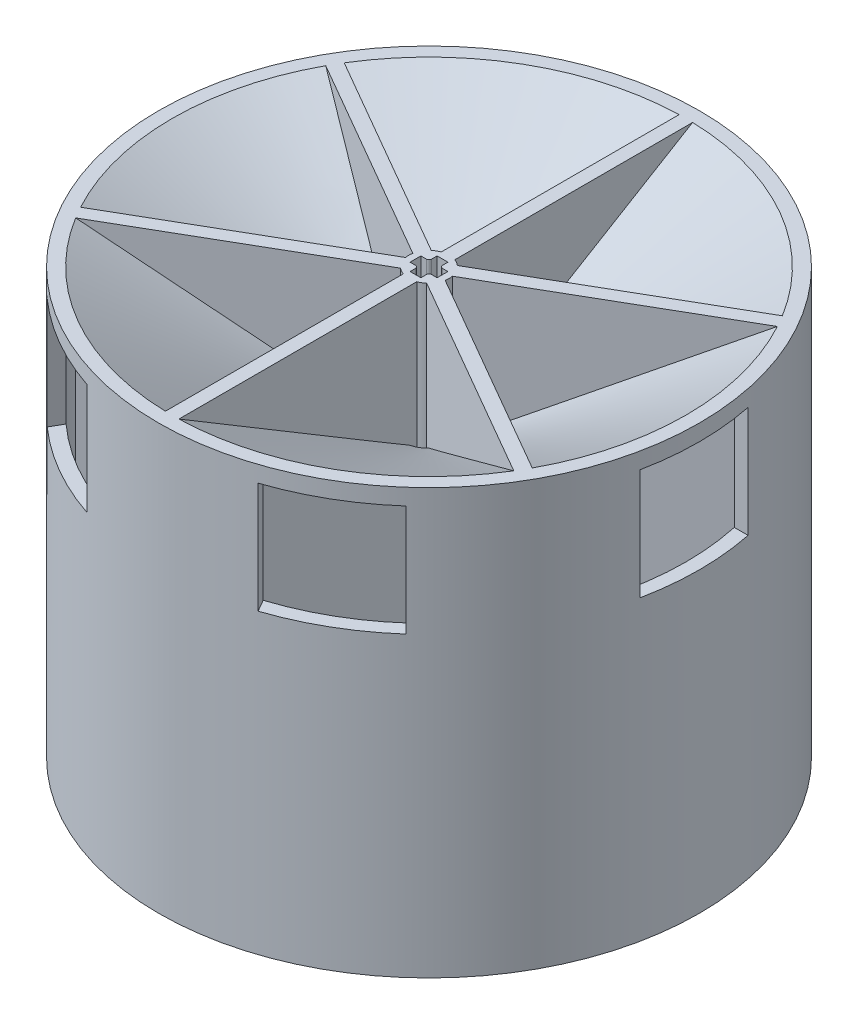
from build123d import *
from build123d.topology import SkipClean

# Parameters (mm, degrees)
SKETCH1_R           = 50.000537734
BOSS_EXTRUDE1_DEPTH = 50
BOSS_EXTRUDE2_START = -30
SKETCH4_R           = 50.000537734
BOSS_EXTRUDE2_DEPTH = 30
CUT_EXTRUDE2_DEPTH  = 25
SKETCH9_R           = 50.000537734
CUT_EXTRUDE3_DEPTH  = 1.5
BOSS_EXTRUDE3_DEPTH = 3
CUT_EXTRUDE4_DEPTH  = 84


with BuildPart() as part:
    # Sketch1 → Boss-Extrude1 (new body)
    with BuildSketch(Plane(origin=(0, 0, 0), x_dir=(1, 0, 0), z_dir=(0, 1, 0))):
        with Locations(Location((0, 0, 0), (0, 0, 270))):
            Circle(SKETCH1_R)
        with BuildLine():
            Line((-40.497426226, -24.824575606), (-2.413888572, -2.83703489))
            ThreePointArc((-2.413888572, -2.83703489), (-1.8625, -3.225944629), (-1.25, -3.50900627))
            Line((-1.25, -3.50900627), (-1.25, -47.484087703))
            ThreePointArc((-1.25, -47.484087703), (-23.750268867, -41.136672371), (-40.497426226, -24.824575606))
        make_face(mode=Mode.SUBTRACT)
        with BuildLine():
            Line((1.25, -47.484087703), (1.25, -3.50900627))
            ThreePointArc((1.25, -3.50900627), (1.8625, -3.225944629), (2.413888572, -2.83703489))
            Line((2.413888572, -2.83703489), (40.497426226, -24.824575606))
            ThreePointArc((40.497426226, -24.824575606), (23.750268867, -41.136672371), (1.25, -47.484087703))
        make_face(mode=Mode.SUBTRACT)
        with BuildLine():
            Line((-41.747426226, -22.659512097), (-3.663888572, -0.67197138))
            ThreePointArc((-3.663888572, -0.67197138), (-3.725, 0), (-3.663888572, 0.67197138))
            Line((-3.663888572, 0.67197138), (-41.747426226, 22.659512097))
            ThreePointArc((-41.747426226, 22.659512097), (-47.500537734, 0), (-41.747426226, -22.659512097))
        make_face(mode=Mode.SUBTRACT)
        with BuildLine():
            Line((-40.497426226, 24.824575606), (-2.413888572, 2.83703489))
            ThreePointArc((-2.413888572, 2.83703489), (-1.8625, 3.225944629), (-1.25, 3.50900627))
            Line((-1.25, 3.50900627), (-1.25, 47.484087703))
            ThreePointArc((-1.25, 47.484087703), (-23.750268867, 41.136672371), (-40.497426226, 24.824575606))
        make_face(mode=Mode.SUBTRACT)
        with BuildLine():
            Line((1.25, 47.484087703), (1.25, 3.50900627))
            ThreePointArc((1.25, 3.50900627), (1.8625, 3.225944629), (2.413888572, 2.83703489))
            Line((2.413888572, 2.83703489), (40.497426226, 24.824575606))
            ThreePointArc((40.497426226, 24.824575606), (23.750268867, 41.136672371), (1.25, 47.484087703))
        make_face(mode=Mode.SUBTRACT)
        with BuildLine():
            Line((41.747426226, 22.659512097), (3.663888572, 0.67197138))
            ThreePointArc((3.663888572, 0.67197138), (3.725, 0), (3.663888572, -0.67197138))
            Line((3.663888572, -0.67197138), (41.747426226, -22.659512097))
            ThreePointArc((41.747426226, -22.659512097), (47.500537734, 0), (41.747426226, 22.659512097))
        make_face(mode=Mode.SUBTRACT)
        with BuildLine():
            Line((-1, 2.5), (1, 2.5))
            Line((1, 2.5), (1, 1.5))
            ThreePointArc((1, 1.5), (1.146446609, 1.146446609), (1.5, 1))
            Line((1.5, 1), (2.5, 1))
            Line((2.5, 1), (2.5, -1))
            Line((2.5, -1), (1.5, -1))
            ThreePointArc((1.5, -1), (1.146446609, -1.146446609), (1, -1.5))
            Line((1, -1.5), (1, -2.5))
            Line((1, -2.5), (-1, -2.5))
            Line((-1, -2.5), (-1, -1.5))
            ThreePointArc((-1, -1.5), (-1.146446609, -1.146446609), (-1.5, -1))
            Line((-1.5, -1), (-2.5, -1))
            Line((-2.5, -1), (-2.5, 1))
            Line((-2.5, 1), (-1.5, 1))
            ThreePointArc((-1.5, 1), (-1.146446609, 1.146446609), (-1, 1.5))
            Line((-1, 1.5), (-1, 2.5))
        make_face(mode=Mode.SUBTRACT)
    extrude(amount=-BOSS_EXTRUDE1_DEPTH)

    # Sketch3 → Revolve1 (revolve)
    with BuildSketch(Plane.XY, mode=Mode.PRIVATE) as revolve1_sk:
        Polygon((1.120312319, 0), (5.082856331, 3.049681), (50.000537734, 30), (50.000537734, 0), (47.500537734, 0), (47.500537734, 25.584548484), (4.859165004, 0), align=None)
    revolve(revolve1_sk.sketch.rotate(Axis((0, 10.437160455, 0), (0, 1, 0)), 270), axis=Axis((0, 10.437160455, 0), (0, 1, 0)))

    # Sketch4 → Boss-Extrude2 (add)
    with SkipClean():  # the faces are left unmerged after this step: merging them gives an invalid solid
        with BuildSketch(Plane.XZ.offset(BOSS_EXTRUDE2_START)):
            with Locations(Location((0, 0, 0), (0, 0, 90))):
                Circle(SKETCH4_R)
            with BuildLine():
                Line((-40.497426226, -24.824575606), (-2.413888572, -2.83703489))
                ThreePointArc((-2.413888572, -2.83703489), (-1.8625, -3.225944629), (-1.25, -3.50900627))
                Line((-1.25, -3.50900627), (-1.25, -47.484087703))
                ThreePointArc((-1.25, -47.484087703), (-23.750268867, -41.136672371), (-40.497426226, -24.824575606))
            make_face(mode=Mode.SUBTRACT)
            with BuildLine():
                Line((1.25, -47.484087703), (1.25, -3.50900627))
                ThreePointArc((1.25, -3.50900627), (1.8625, -3.225944629), (2.413888572, -2.83703489))
                Line((2.413888572, -2.83703489), (40.497426226, -24.824575606))
                ThreePointArc((40.497426226, -24.824575606), (23.750268867, -41.136672371), (1.25, -47.484087703))
            make_face(mode=Mode.SUBTRACT)
            with BuildLine():
                Line((-41.747426226, -22.659512097), (-3.663888572, -0.67197138))
                ThreePointArc((-3.663888572, -0.67197138), (-3.725, 0), (-3.663888572, 0.67197138))
                Line((-3.663888572, 0.67197138), (-41.747426226, 22.659512097))
                ThreePointArc((-41.747426226, 22.659512097), (-47.500537734, 0), (-41.747426226, -22.659512097))
            make_face(mode=Mode.SUBTRACT)
            with BuildLine():
                Line((-40.497426226, 24.824575606), (-2.413888572, 2.83703489))
                ThreePointArc((-2.413888572, 2.83703489), (-1.8625, 3.225944629), (-1.25, 3.50900627))
                Line((-1.25, 3.50900627), (-1.25, 47.484087703))
                ThreePointArc((-1.25, 47.484087703), (-23.750268867, 41.136672371), (-40.497426226, 24.824575606))
            make_face(mode=Mode.SUBTRACT)
            with BuildLine():
                Line((1.25, 47.484087703), (1.25, 3.50900627))
                ThreePointArc((1.25, 3.50900627), (1.8625, 3.225944629), (2.413888572, 2.83703489))
                Line((2.413888572, 2.83703489), (40.497426226, 24.824575606))
                ThreePointArc((40.497426226, 24.824575606), (23.750268867, 41.136672371), (1.25, 47.484087703))
            make_face(mode=Mode.SUBTRACT)
            with BuildLine():
                Line((41.747426226, 22.659512097), (3.663888572, 0.67197138))
                ThreePointArc((3.663888572, 0.67197138), (3.725, 0), (3.663888572, -0.67197138))
                Line((3.663888572, -0.67197138), (41.747426226, -22.659512097))
                ThreePointArc((41.747426226, -22.659512097), (47.500537734, 0), (41.747426226, 22.659512097))
            make_face(mode=Mode.SUBTRACT)
            with BuildLine():
                Line((-1, 2.5), (1, 2.5))
                Line((1, 2.5), (1, 1.5))
                ThreePointArc((1, 1.5), (1.146446609, 1.146446609), (1.5, 1))
                Line((1.5, 1), (2.5, 1))
                Line((2.5, 1), (2.5, -1))
                Line((2.5, -1), (1.5, -1))
                ThreePointArc((1.5, -1), (1.146446609, -1.146446609), (1, -1.5))
                Line((1, -1.5), (1, -2.5))
                Line((1, -2.5), (-1, -2.5))
                Line((-1, -2.5), (-1, -1.5))
                ThreePointArc((-1, -1.5), (-1.146446609, -1.146446609), (-1.5, -1))
                Line((-1.5, -1), (-2.5, -1))
                Line((-2.5, -1), (-2.5, 1))
                Line((-2.5, 1), (-1.5, 1))
                ThreePointArc((-1.5, 1), (-1.146446609, 1.146446609), (-1, 1.5))
                Line((-1, 1.5), (-1, 2.5))
            make_face(mode=Mode.SUBTRACT)
        extrude(amount=BOSS_EXTRUDE2_DEPTH)

    # Sketch7 → Cut-Extrude2 (cut)
    with BuildSketch(Plane(origin=(0, 30, 0), x_dir=(1, 0, 0), z_dir=(0, 1, 0))):
        with BuildLine():
            Line((14.557740519, -45.214746223), (15.834917801, -47.426882165))
            ThreePointArc((15.834917801, -47.426882165), (25.000268867, -43.30173588), (33.155425877, -37.426882165))
            Line((33.155425877, -37.426882165), (31.878248595, -35.214746223))
            ThreePointArc((31.878248595, -35.214746223), (23.750268867, -41.136672371), (14.557740519, -45.214746223))
        make_face()
        with BuildLine():
            Line((46.435989114, -10), (48.990343678, -10))
            ThreePointArc((48.990343678, -10), (50.000537734, 0), (48.990343678, 10))
            Line((48.990343678, 10), (46.435989114, 10))
            ThreePointArc((46.435989114, 10), (47.500537734, 0), (46.435989114, -10))
        make_face()
        with BuildLine():
            Line((-31.878248595, -35.214746223), (-33.155425877, -37.426882165))
            ThreePointArc((-33.155425877, -37.426882165), (-25.000268867, -43.30173588), (-15.834917801, -47.426882165))
            Line((-15.834917801, -47.426882165), (-14.557740519, -45.214746223))
            ThreePointArc((-14.557740519, -45.214746223), (-23.750268867, -41.136672371), (-31.878248595, -35.214746223))
        make_face()
        with BuildLine():
            Line((-46.435989114, 10), (-48.990343678, 10))
            ThreePointArc((-48.990343678, 10), (-50.000537734, 0), (-48.990343678, -10))
            Line((-48.990343678, -10), (-46.435989114, -10))
            ThreePointArc((-46.435989114, -10), (-47.500537734, 0), (-46.435989114, 10))
        make_face()
        with BuildLine():
            Line((-14.557740519, 45.214746223), (-15.834917801, 47.426882165))
            ThreePointArc((-15.834917801, 47.426882165), (-25.000268867, 43.30173588), (-33.155425877, 37.426882165))
            Line((-33.155425877, 37.426882165), (-31.878248595, 35.214746223))
            ThreePointArc((-31.878248595, 35.214746223), (-23.750268867, 41.136672371), (-14.557740519, 45.214746223))
        make_face()
        with BuildLine():
            Line((31.878248595, 35.214746223), (33.155425877, 37.426882165))
            ThreePointArc((33.155425877, 37.426882165), (25.000268867, 43.30173588), (15.834917801, 47.426882165))
            Line((15.834917801, 47.426882165), (14.557740519, 45.214746223))
            ThreePointArc((14.557740519, 45.214746223), (23.750268867, 41.136672371), (31.878248595, 35.214746223))
        make_face()
    extrude(amount=-CUT_EXTRUDE2_DEPTH, mode=Mode.SUBTRACT)

    # Sketch9 → Cut-Extrude3 (cut)
    with BuildSketch(Plane(origin=(0, 30, 0), x_dir=(1, 0, 0), z_dir=(0, 1, 0))):
        with Locations(Location((0, 0, 0), (0, 0, 270))):
            Circle(SKETCH9_R)
    extrude(amount=-CUT_EXTRUDE3_DEPTH, mode=Mode.SUBTRACT)

    # Sketch11 → Boss-Extrude3 (add)
    with BuildSketch(Plane(origin=(0, 28.5, 0), x_dir=(1, 0, 0), z_dir=(0, 1, 0))):
        with BuildLine():
            Line((14.557740519, -45.214746223), (15.834917801, -47.426882165))
            ThreePointArc((15.834917801, -47.426882165), (25.000268867, -43.30173588), (33.155425877, -37.426882165))
            Line((33.155425877, -37.426882165), (31.878248595, -35.214746223))
            ThreePointArc((31.878248595, -35.214746223), (23.750268867, -41.136672371), (14.557740519, -45.214746223))
        make_face()
        with BuildLine():
            Line((46.435989114, -10), (48.990343678, -10))
            ThreePointArc((48.990343678, -10), (50.000537734, 0), (48.990343678, 10))
            Line((48.990343678, 10), (46.435989114, 10))
            ThreePointArc((46.435989114, 10), (47.500537734, 0), (46.435989114, -10))
        make_face()
        with BuildLine():
            Line((-31.878248595, -35.214746223), (-33.155425877, -37.426882165))
            ThreePointArc((-33.155425877, -37.426882165), (-25.000268867, -43.30173588), (-15.834917801, -47.426882165))
            Line((-15.834917801, -47.426882165), (-14.557740519, -45.214746223))
            ThreePointArc((-14.557740519, -45.214746223), (-23.750268867, -41.136672371), (-31.878248595, -35.214746223))
        make_face()
        with BuildLine():
            Line((-46.435989114, 10), (-48.990343678, 10))
            ThreePointArc((-48.990343678, 10), (-50.000537734, 0), (-48.990343678, -10))
            Line((-48.990343678, -10), (-46.435989114, -10))
            ThreePointArc((-46.435989114, -10), (-47.500537734, 0), (-46.435989114, 10))
        make_face()
        with BuildLine():
            Line((-14.557740519, 45.214746223), (-15.834917801, 47.426882165))
            ThreePointArc((-15.834917801, 47.426882165), (-25.000268867, 43.30173588), (-33.155425877, 37.426882165))
            Line((-33.155425877, 37.426882165), (-31.878248595, 35.214746223))
            ThreePointArc((-31.878248595, 35.214746223), (-23.750268867, 41.136672371), (-14.557740519, 45.214746223))
        make_face()
        with BuildLine():
            Line((31.878248595, 35.214746223), (33.155425877, 37.426882165))
            ThreePointArc((33.155425877, 37.426882165), (25.000268867, 43.30173588), (15.834917801, 47.426882165))
            Line((15.834917801, 47.426882165), (14.557740519, 45.214746223))
            ThreePointArc((14.557740519, 45.214746223), (23.750268867, 41.136672371), (31.878248595, 35.214746223))
        make_face()
    extrude(amount=-BOSS_EXTRUDE3_DEPTH)

    # Sketch12 → Cut-Extrude4 (cut)
    with BuildSketch(Plane(origin=(0, 28.5, 0), x_dir=(1, 0, 0), z_dir=(0, 1, 0))):
        with BuildLine():
            Line((-1, 2.5), (1, 2.5))
            Line((1, 2.5), (1, 1.5))
            ThreePointArc((1, 1.5), (1.146446609, 1.146446609), (1.5, 1))
            Line((1.5, 1), (2.5, 1))
            Line((2.5, 1), (2.5, -1))
            Line((2.5, -1), (1.5, -1))
            ThreePointArc((1.5, -1), (1.146446609, -1.146446609), (1, -1.5))
            Line((1, -1.5), (1, -2.5))
            Line((1, -2.5), (-1, -2.5))
            Line((-1, -2.5), (-1, -1.5))
            ThreePointArc((-1, -1.5), (-1.146446609, -1.146446609), (-1.5, -1))
            Line((-1.5, -1), (-2.5, -1))
            Line((-2.5, -1), (-2.5, 1))
            Line((-2.5, 1), (-1.5, 1))
            ThreePointArc((-1.5, 1), (-1.146446609, 1.146446609), (-1, 1.5))
            Line((-1, 1.5), (-1, 2.5))
        make_face()
    extrude(amount=-CUT_EXTRUDE4_DEPTH, mode=Mode.SUBTRACT)


solid = part.part
